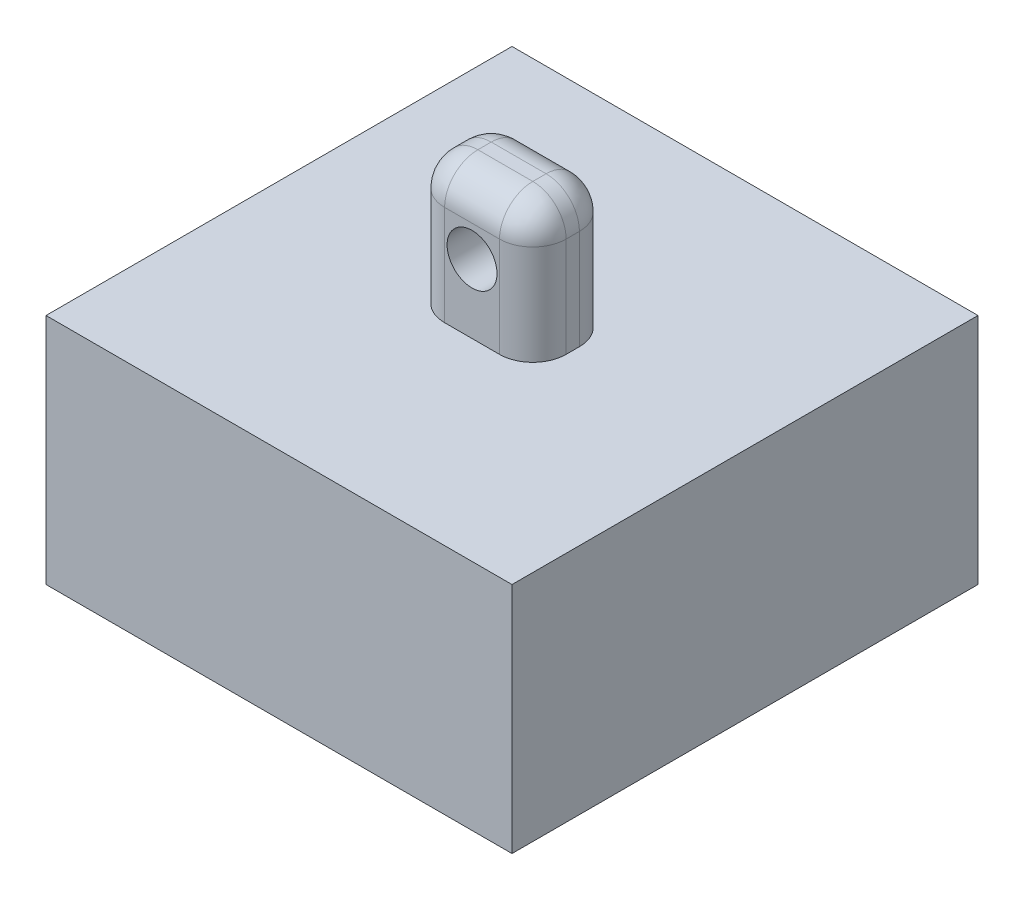
from build123d import *

# Parameters (mm, degrees)
SKETCH1_W           = 28
SKETCH1_H           = 28
SKETCH1_W_2         = 21
SKETCH1_H_2         = 21
BOSS_EXTRUDE1_DEPTH = 11
SKETCH2_W           = 28
SKETCH2_H           = 28
BOSS_EXTRUDE2_DEPTH = 3
SKETCH3_W           = 7.3
SKETCH3_H           = 4.8
BOSS_EXTRUDE3_DEPTH = 8
FILLET3_R           = 2
SKETCH4_R           = 1.5
CUT_EXTRUDE1_DEPTH  = 5


with BuildPart() as part:
    # Sketch1 → Boss-Extrude1 (new body)
    with BuildSketch(Plane(origin=(0, 0, 0), x_dir=(1, 0, 0), z_dir=(0, 1, 0))):
        Rectangle(SKETCH1_W, SKETCH1_H)
        Rectangle(SKETCH1_W_2, SKETCH1_H_2, mode=Mode.SUBTRACT)
    extrude(amount=BOSS_EXTRUDE1_DEPTH)

    # Sketch2 → Boss-Extrude2 (add)
    with BuildSketch(Plane(origin=(0, 11, 0), x_dir=(1, 0, 0), z_dir=(0, 1, 0))):
        Rectangle(SKETCH2_W, SKETCH2_H)
    extrude(amount=BOSS_EXTRUDE2_DEPTH)

    # Sketch3 → Boss-Extrude3 (add)
    with BuildSketch(Plane(origin=(0, 14, 0), x_dir=(1, 0, 0), z_dir=(0, 1, 0))):
        Rectangle(SKETCH3_W, SKETCH3_H)
    extrude(amount=BOSS_EXTRUDE3_DEPTH)

    # Fillet3
    fillet3_edges = [part.edges().sort_by_distance(p)[0] for p in [
        (-3.65, 18, -2.4),
        (-3.65, 18, 2.4),
        (3.65, 18, 2.4),
        (3.65, 18, -2.4),
        (-3.65, 22, 0),
        (0, 22, 2.4),
        (3.65, 22, 0),
        (0, 22, -2.4),
    ]]
    fillet(fillet3_edges, radius=FILLET3_R)

    # Sketch4 → Cut-Extrude1 (cut)
    with BuildSketch(Plane(origin=(0, 0, -2.4), x_dir=(-1, 0, 0), z_dir=(0, 0, -1))):
        with Locations((0, 18.128577291)):
            Circle(SKETCH4_R)
    extrude(amount=-CUT_EXTRUDE1_DEPTH, mode=Mode.SUBTRACT)


solid = part.part
